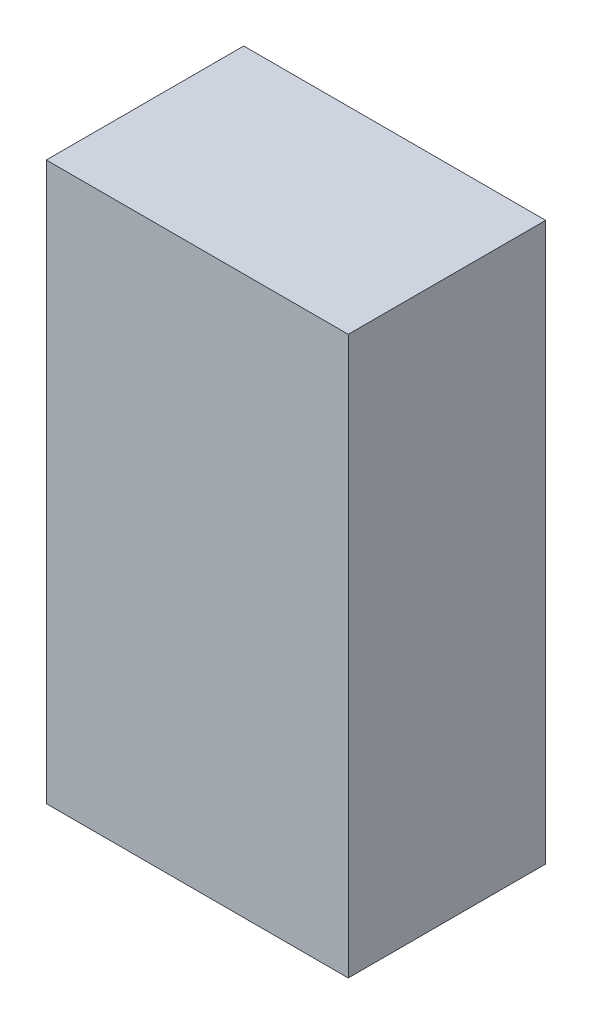
from build123d import *

# Parameters (mm, degrees)
SKETCH1_W           = 26
SKETCH1_H           = 48
BOSS_EXTRUDE1_DEPTH = 8.5


with BuildPart() as part:
    # Sketch1 → Boss-Extrude1 (new, symmetric)
    with BuildSketch(Plane.XY):
        Rectangle(SKETCH1_W, SKETCH1_H)
    extrude(amount=BOSS_EXTRUDE1_DEPTH, both=True)


solid = part.part
